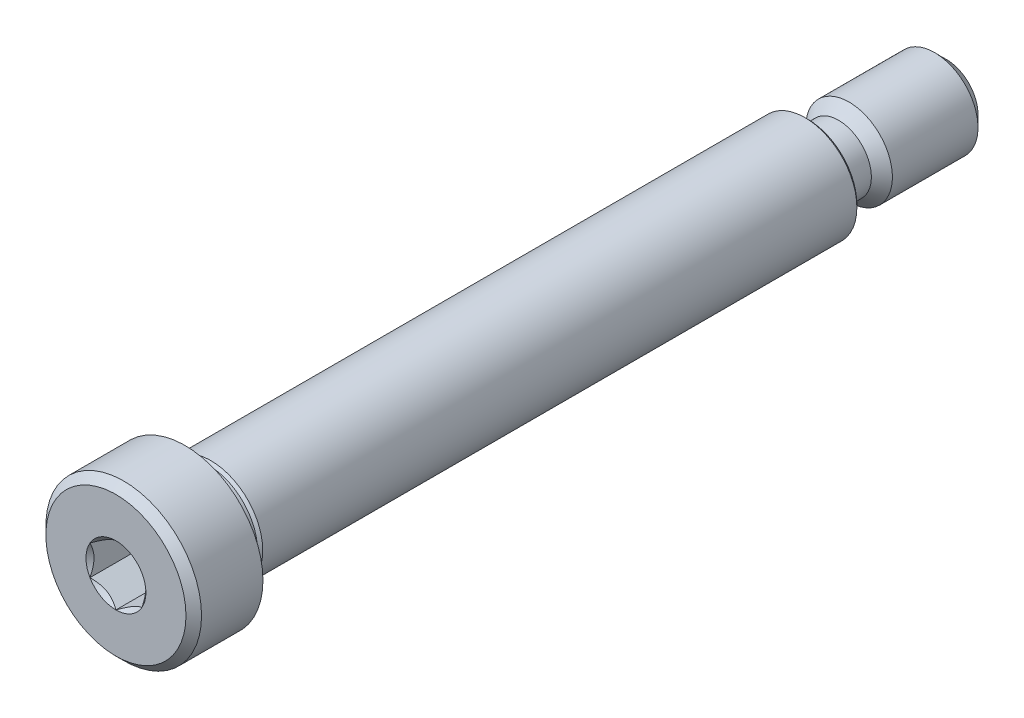
from build123d import *

# Parameters (mm, degrees)
CUT_EXTRUDE1_DEPTH = 4.7625


with BuildPart() as part:
    # Sketch4 → Revolve1 (revolve)
    with BuildSketch(Plane(origin=(0, 0, 0), x_dir=(0, 0, -1), z_dir=(1, 0, 0))):
        Polygon((-31.75, 7.14375), (-37.385625, 7.14375), (-38.1, 6.429375), (-38.1, 0), (25.4, 0), (25.4, 4.500033333), (25.137533333, 4.7625), (-29.3878, 4.7625), (-29.625925, 4.524375), (-31.511875, 4.524375), (-31.75, 4.7625), align=None)
    revolve(axis=Axis((0, 0, 38.1), (0, 0, -1)))

    # Sketch5 → Cut-Extrude1 (cut)
    with BuildSketch(Plane.XY.offset(38.1)):
        Polygon((2.38125, 1.374815329), (0, 2.749630657), (-2.38125, 1.374815329), (-2.38125, -1.374815329), (0, -2.749630657), (2.38125, -1.374815329), align=None)
    extrude(amount=-CUT_EXTRUDE1_DEPTH, mode=Mode.SUBTRACT)

    # Cut-Extrude4 cone 1 section (through the dimple's axis) → Cut-Extrude4 (revolve, cut)
    with BuildSketch(Plane(origin=(0, 0, 38.1), x_dir=(0, -1, 0), z_dir=(1, 0, 0))):
        Polygon((0, 0), (2.749630657, 0), (0, 2.749630657), align=None)
    revolve(axis=Axis((0, 0, 38.1), (0, 0, -1)), mode=Mode.SUBTRACT)

    # Sketch7 → Revolve2 (revolve)
    with BuildSketch(Plane(origin=(0, 0, 0), x_dir=(0, 0, -1), z_dir=(1, 0, 0))):
        Polygon((25.4, 3.9751), (37.041666667, 3.9751), (38.1, 2.916766667), (38.1, 0), (25.4, 0), align=None)
    revolve(axis=Axis((0, 0, -38.1), (0, 0, 1)))

    # Sketch10 → Cut-Revolve1 (revolve, cut)
    with BuildSketch(Plane(origin=(0, 0, 0), x_dir=(0, 0, -1), z_dir=(1, 0, 0))):
        with BuildLine():
            Line((26.3652, 3.0099), (28.2194, 3.0099))
            Line((28.2194, 3.0099), (29.972, 4.7625))
            Line((29.972, 4.7625), (25.4, 4.7625))
            Line((25.4, 4.7625), (25.4, 3.9751))
            ThreePointArc((25.4, 3.9751), (25.682700535, 3.292600535), (26.3652, 3.0099))
        make_face()
    revolve(axis=Axis((0, 0, -38.1), (0, 0, 1)), mode=Mode.SUBTRACT)


solid = part.part
